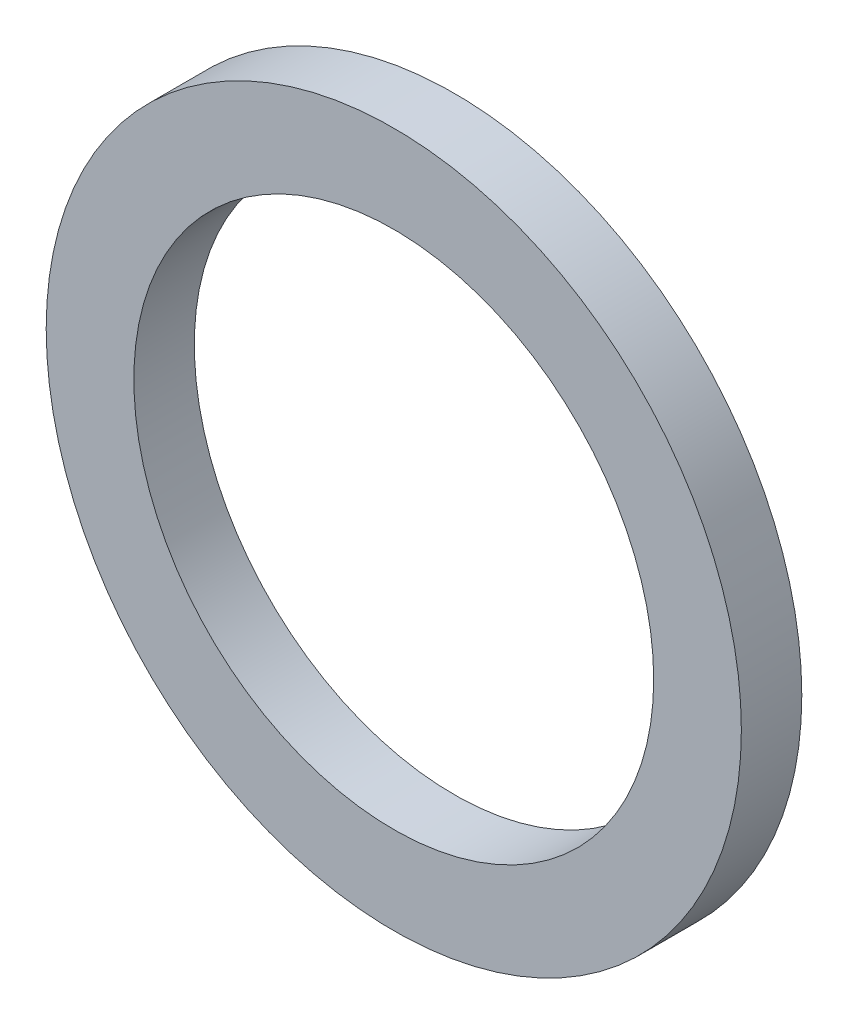
from build123d import *

# Parameters (mm, degrees)
SKETCH_1_R      = 11.5
SKETCH_1_R_2    = 8.6
EXTRUDE_1_DEPTH = 2


with BuildPart() as part:
    # Эскиз1 → Бобышка-Вытянуть1 (new body)
    with BuildSketch(Plane.XY):
        Circle(SKETCH_1_R)
        Circle(SKETCH_1_R_2, mode=Mode.SUBTRACT)
    extrude(amount=EXTRUDE_1_DEPTH)


solid = part.part
